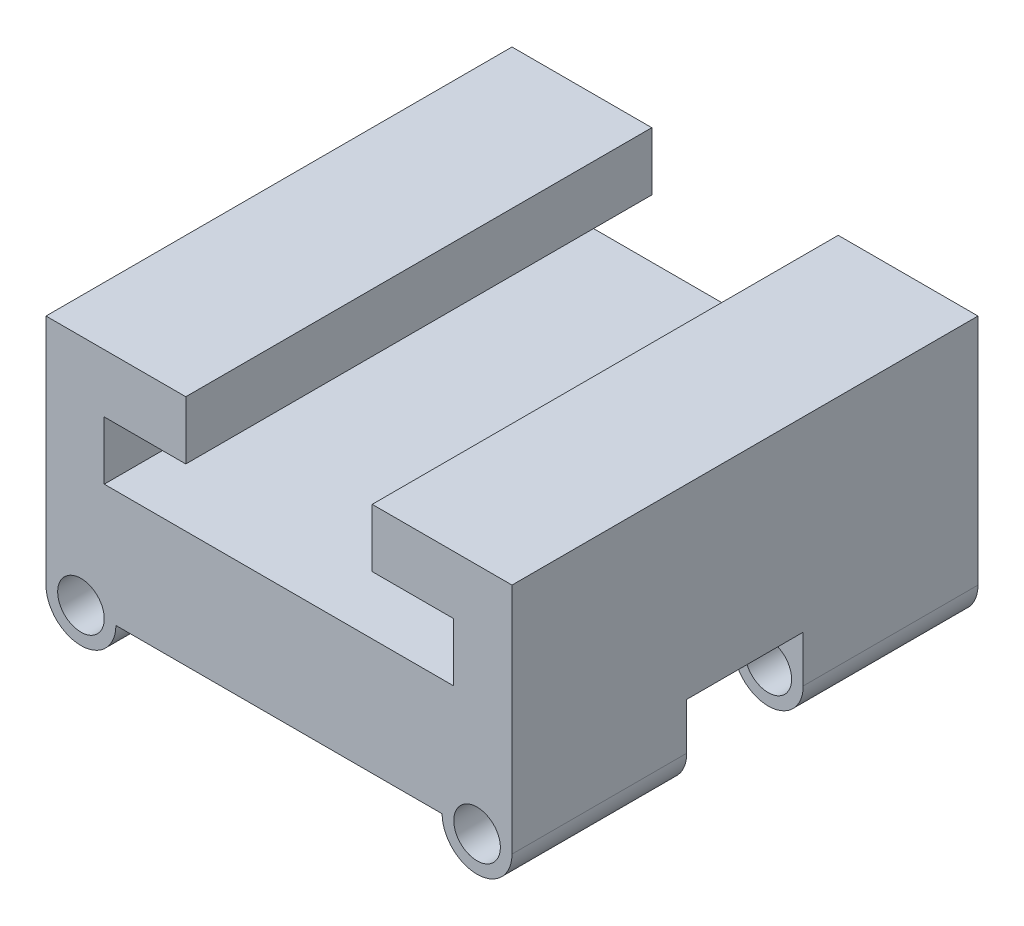
from build123d import *

# Parameters (mm, degrees)
BOSS_EXTRUDE1_DEPTH     = 40
BOSS_EXTRUDE2_DEPTH     = 15
SKETCH9_R               = 3
BOSS_EXTRUDE3_DEPTH     = 40
CUT_EXTRUDE2_DEPTH      = 10
F_4_0_MM_DOWEL_HOLES2_D = 4


with BuildPart() as part:
    # Sketch2 → Boss-Extrude1 (new body)
    with BuildSketch(Plane.XY):
        Polygon((-20, 20), (-8, 20), (-8, 15), (-15, 15), (-15, 10), (15, 10), (15, 15), (8, 15), (8, 20), (20, 20), (20, 0), (-20, 0), align=None)
    extrude(amount=BOSS_EXTRUDE1_DEPTH)

    # Sketch3 → Boss-Extrude2 (add)
    with BuildSketch(Plane(origin=(0, 0, 0), x_dir=(-1, 0, 0), z_dir=(0, 0, -1))):
        with BuildLine():
            Line((-20, 0), (-14, 0))
            ThreePointArc((-14, 0), (-17, -3), (-20, 0))
        make_face()
    boss_extrude2 = extrude(amount=-BOSS_EXTRUDE2_DEPTH)

    # Mirror1: Boss-Extrude2 across plane
    add(boss_extrude2.mirror(Plane(origin=(0, 0, 20), x_dir=(1, 0, 0), z_dir=(0, 0, -1))))

    # Sketch9 → Boss-Extrude3 (add)
    with BuildSketch(Plane(origin=(0, 0, 0), x_dir=(-1, 0, 0), z_dir=(0, 0, -1))):
        with Locations((17, 0)):
            Circle(SKETCH9_R)
    extrude(amount=-BOSS_EXTRUDE3_DEPTH)

    # Sketch10 → Cut-Extrude2 (cut)
    with BuildSketch(Plane(origin=(0, 0, 25), x_dir=(-1, 0, 0), z_dir=(0, 0, -1))):
        with BuildLine():
            Line((-17, 4), (-20, 4))
            Line((-20, 4), (-20, 2.645751311))
            ThreePointArc((-20, 2.645751311), (-15.354248689, -3.645751311), (-17, 4))
        make_face()
    extrude(amount=CUT_EXTRUDE2_DEPTH, mode=Mode.SUBTRACT)

    # Ø4.0 mm Dowel Holes2 (through all)
    with Locations(Plane(origin=(0, 0, 0), x_dir=(-1, 0, 0), z_dir=(0, 0, -1))):
        with Locations((-17, 0)):
            f_4_0_mm_dowel_holes2 = Hole(F_4_0_MM_DOWEL_HOLES2_D / 2)

    # Mirror5: Ø4.0 mm Dowel Holes2 across plane
    add(f_4_0_mm_dowel_holes2.mirror(Plane.ZY), mode=Mode.SUBTRACT)


solid = part.part
